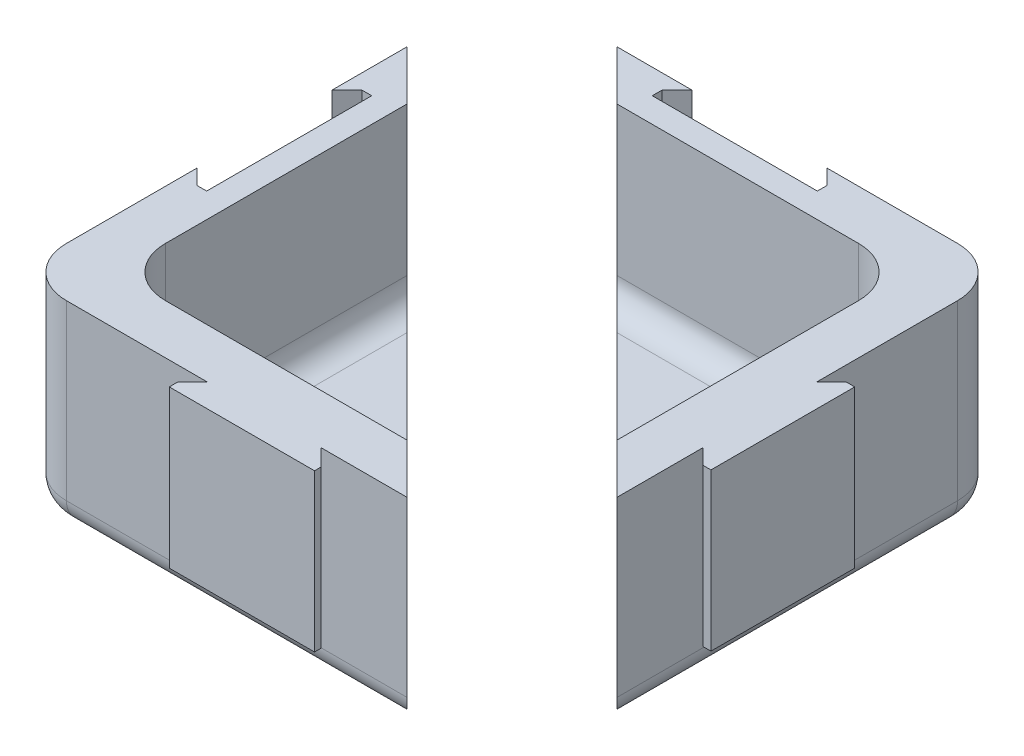
from build123d import *

# Parameters (mm, degrees)
SKETCH1_W                    = 100
SKETCH1_H                    = 100
BOSS_EXTRUDE1_DEPTH          = 40
SHELL1_T                     = -10
SHELL1_THICKNESS_2_FACE_W    = 80
SHELL1_THICKNESS_2_FACE_H    = 80
SHELL1_THICKNESS_2_DEPTH     = 5
CUT_EXTRUDE1_DEPTH           = 32
BOSS_EXTRUDE2_DEPTH          = 31.7
CUT_EXTRUDE2_DEPTH           = 32
BOSS_EXTRUDE3_DEPTH          = 31.7
FILLET1_R                    = 10
FILLET2_R                    = 5
CUT_EXTRUDE_THIN1_DEPTH      = 88.087197681
CUT_EXTRUDE_THIN1_DEPTH_BACK = 88.087197681


with BuildPart() as part:
    # Sketch1 → Boss-Extrude1 (new body)
    with BuildSketch(Plane(origin=(0, 0, 0), x_dir=(1, 0, 0), z_dir=(0, 1, 0))):
        Rectangle(SKETCH1_W, SKETCH1_H)
    extrude(amount=BOSS_EXTRUDE1_DEPTH)

    # Shell1
    shell1_openings = [part.faces().sort_by_distance(p)[0] for p in [
        (0, 40, 0),
    ]]
    offset(amount=SHELL1_T, openings=shell1_openings, kind=Kind.INTERSECTION)

    # Shell1 thickness 2 face (on inner face of the shell) → Shell1 thickness 2 (cut)
    with BuildSketch(Plane(origin=(0, 10, 0), x_dir=(0, 0, -1), z_dir=(0, -1, 0))):
        Rectangle(SHELL1_THICKNESS_2_FACE_W, SHELL1_THICKNESS_2_FACE_H)
    extrude(amount=SHELL1_THICKNESS_2_DEPTH, mode=Mode.SUBTRACT)

    # Sketch2 → Cut-Extrude1 (cut)
    with BuildSketch(Plane(origin=(0, 40, 0), x_dir=(1, 0, 0), z_dir=(0, 1, 0))):
        Polygon((-13.666666667, 50), (-16.666666667, 47), (-16.666666667, 45), (16.666666667, 45), (16.666666667, 47), (13.666666667, 50), align=None)
    extrude(amount=-CUT_EXTRUDE1_DEPTH, mode=Mode.SUBTRACT)

    # Sketch3 → Boss-Extrude2 (add)
    with BuildSketch(Plane(origin=(0, 40, 0), x_dir=(1, 0, 0), z_dir=(0, 1, 0))):
        Polygon((-11.454534632, -50), (-14.516666667, -53.062132034), (-14.516666667, -54.7), (14.816666667, -54.7), (14.816666667, -53.362132034), (11.454534632, -50), align=None)
    extrude(amount=-BOSS_EXTRUDE2_DEPTH)

    # Sketch4 → Cut-Extrude2 (cut)
    with BuildSketch(Plane(origin=(0, 40, 0), x_dir=(1, 0, 0), z_dir=(0, 1, 0))):
        Polygon((-45, 16.666666667), (-45, -16.666666667), (-47, -16.666666667), (-50, -13.666666667), (-50, 13.666666667), (-47, 16.666666667), align=None)
    extrude(amount=-CUT_EXTRUDE2_DEPTH, mode=Mode.SUBTRACT)

    # Sketch5 → Boss-Extrude3 (add)
    with BuildSketch(Plane(origin=(0, 40, 0), x_dir=(1, 0, 0), z_dir=(0, 1, 0))):
        Polygon((50, 11.454534632), (50, -11.454534632), (53.062132034, -14.516666667), (54.7, -14.516666667), (54.7, 14.516666667), (53.062132034, 14.516666667), align=None)
    extrude(amount=-BOSS_EXTRUDE3_DEPTH)

    # Fillet1
    fillet1_edges = [part.edges().sort_by_distance(p)[0] for p in [
        (40, 22.5, 40),
        (40, 22.5, -40),
        (-40, 22.5, -40),
        (-40, 22.5, 40),
        (50, 20, 50),
        (-50, 20, 50),
        (-50, 20, -50),
        (50, 20, -50),
    ]]
    fillet(fillet1_edges, radius=FILLET1_R)

    # Fillet2
    fillet2_edges = [part.edges().sort_by_distance(p)[0] for p in [
        (0, 0, -50),
        (50, 0, 0),
        (0, 0, 50),
        (-50, 0, 0),
        (47.071067812, 0, 47.071067812),
        (-47.071067812, 0, 47.071067812),
        (-47.071067812, 0, -47.071067812),
        (47.071067812, 0, -47.071067812),
        (40, 5, 0),
        (0, 5, -40),
        (-40, 5, 0),
        (0, 5, 40),
        (37.071067812, 5, 37.071067812),
        (-37.071067812, 5, 37.071067812),
        (-37.071067812, 5, -37.071067812),
        (37.071067812, 5, -37.071067812),
    ]]
    fillet(fillet2_edges, radius=FILLET2_R)

    # Sketch7 → Cut-Extrude-Thin1 (cut, two sides: drawn at the far end of the back side and taken through both)
    with BuildSketch(Plane(origin=(0, 40, 0), x_dir=(1, 0, 0), z_dir=(0, 1, 0)).offset(-CUT_EXTRUDE_THIN1_DEPTH_BACK)):
        Polygon((-57.67766953, 36.464466094), (36.464466094, -57.67766953), (57.67766953, -36.464466094), (-36.464466094, 57.67766953), align=None)
    extrude(amount=CUT_EXTRUDE_THIN1_DEPTH + CUT_EXTRUDE_THIN1_DEPTH_BACK, mode=Mode.SUBTRACT)


with BuildPart() as cut_extrude_thin1_piece_1:
    # of the separate pieces the step leaves, piece 1, a body of its own (cut_extrude_thin1_pieces)
    add(part.part.solids().sort_by_distance((-40, 40, 50))[0])


with BuildPart() as cut_extrude_thin1_piece_2:
    # of the separate pieces the step leaves, piece 2, a body of its own (cut_extrude_thin1_pieces)
    add(part.part.solids().sort_by_distance((-28.786796564, 5, -50))[0])


solid = Compound([cut_extrude_thin1_piece_1.part, cut_extrude_thin1_piece_2.part])
